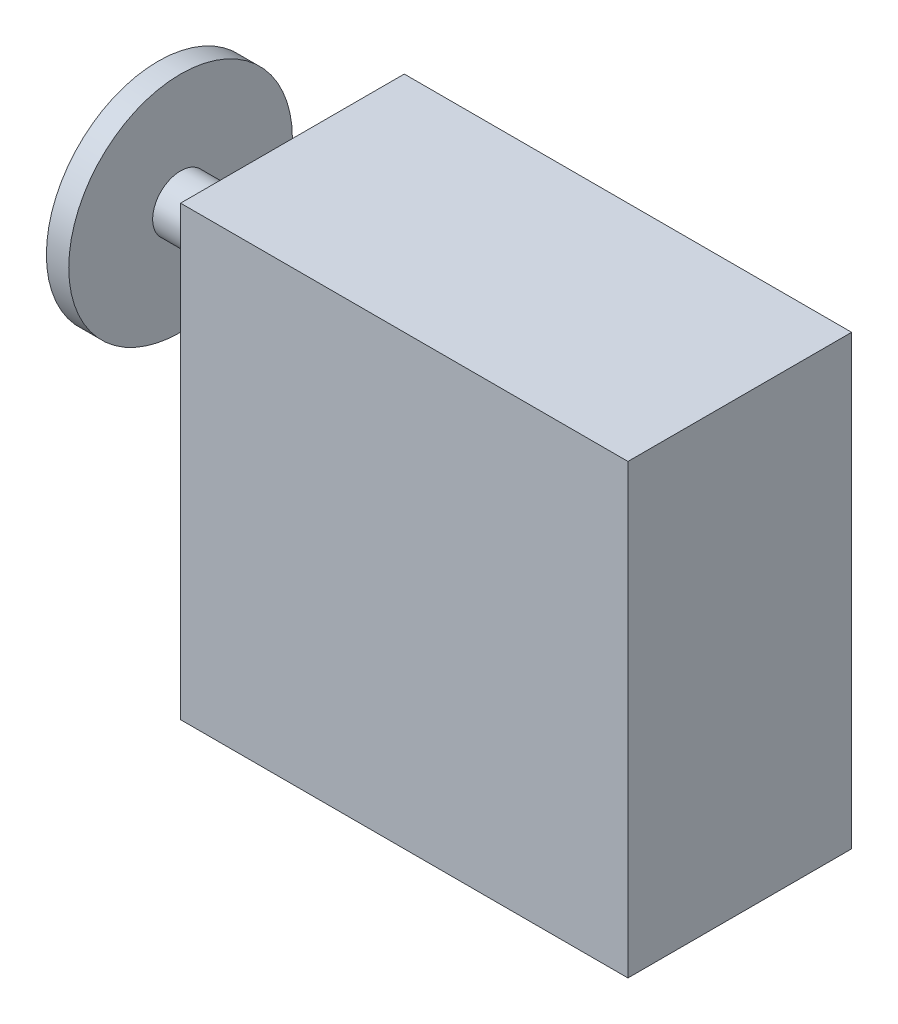
from build123d import *

# Parameters (mm, degrees)
SKETCH_1_W      = 40
SKETCH_1_H      = 40
EXTRUDE_1_DEPTH = 20
SKETCH_2_R      = 2.5
EXTRUDE_2_DEPTH = 10
SKETCH_3_R      = 10
EXTRUDE_3_DEPTH = 2


with BuildPart() as part:
    # 草图1 → 凸台-拉伸1 (new body)
    with BuildSketch(Plane.XY):
        Rectangle(SKETCH_1_W, SKETCH_1_H)
    extrude(amount=EXTRUDE_1_DEPTH)

    # 草图2 → 凸台-拉伸2 (add)
    with BuildSketch(Plane.ZY.offset(20)):
        with Locations(Location((10, 10, 0), (0, 0, 180))):
            Circle(SKETCH_2_R)
    extrude(amount=EXTRUDE_2_DEPTH)

    # 草图3 → 凸台-拉伸3 (add)
    with BuildSketch(Plane.ZY.offset(30)):
        with Locations((10, 10)):
            Circle(SKETCH_3_R)
    extrude(amount=EXTRUDE_3_DEPTH)


solid = part.part
